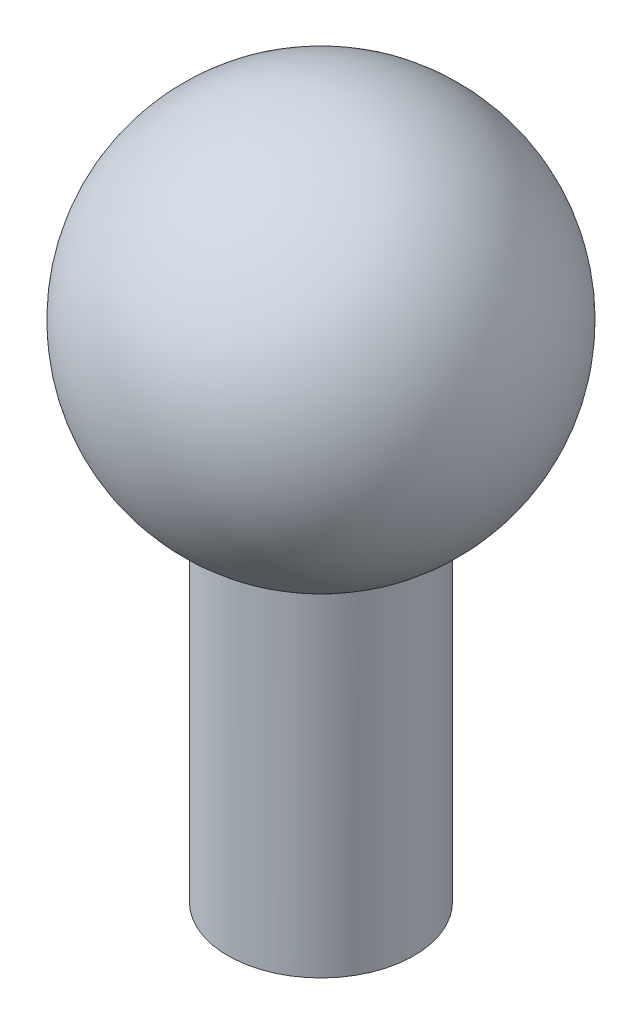
from build123d import *

# Parameters (mm, degrees)
SKETCH2_R          = 10
SKETCH2_R_2        = 5
CUT_EXTRUDE1_DEPTH = 30


with BuildPart() as part:
    # Sketch1 → Revolve1 (revolve)
    with BuildSketch(Plane.XY, mode=Mode.PRIVATE) as revolve1_sk:
        with BuildLine():
            Line((0, 0), (-12, 0))
            Line((-12, 0), (-12, 43.068287801))
            ThreePointArc((-12, 43.068287801), (-24.220784514, 71.193028137), (0, 90))
            Line((0, 90), (0, 0))
        make_face()
    revolve(revolve1_sk.sketch.rotate(Axis((0, 0, 0), (0, 1, 0)), 180), axis=Axis((0, 0, 0), (0, 1, 0)))

    # Sketch2 → Cut-Extrude1 (cut)
    with BuildSketch(Plane(origin=(0, 0, 0), x_dir=(-1, 0, 0), z_dir=(0, -1, 0))):
        with Locations(Location((0, 0, 0), (0, 0, 90))):
            Circle(SKETCH2_R)
        with Locations((0, -22)):
            Circle(SKETCH2_R_2)
        with Locations((0, 22)):
            Circle(SKETCH2_R_2)
    extrude(amount=-CUT_EXTRUDE1_DEPTH, mode=Mode.SUBTRACT)


solid = part.part
